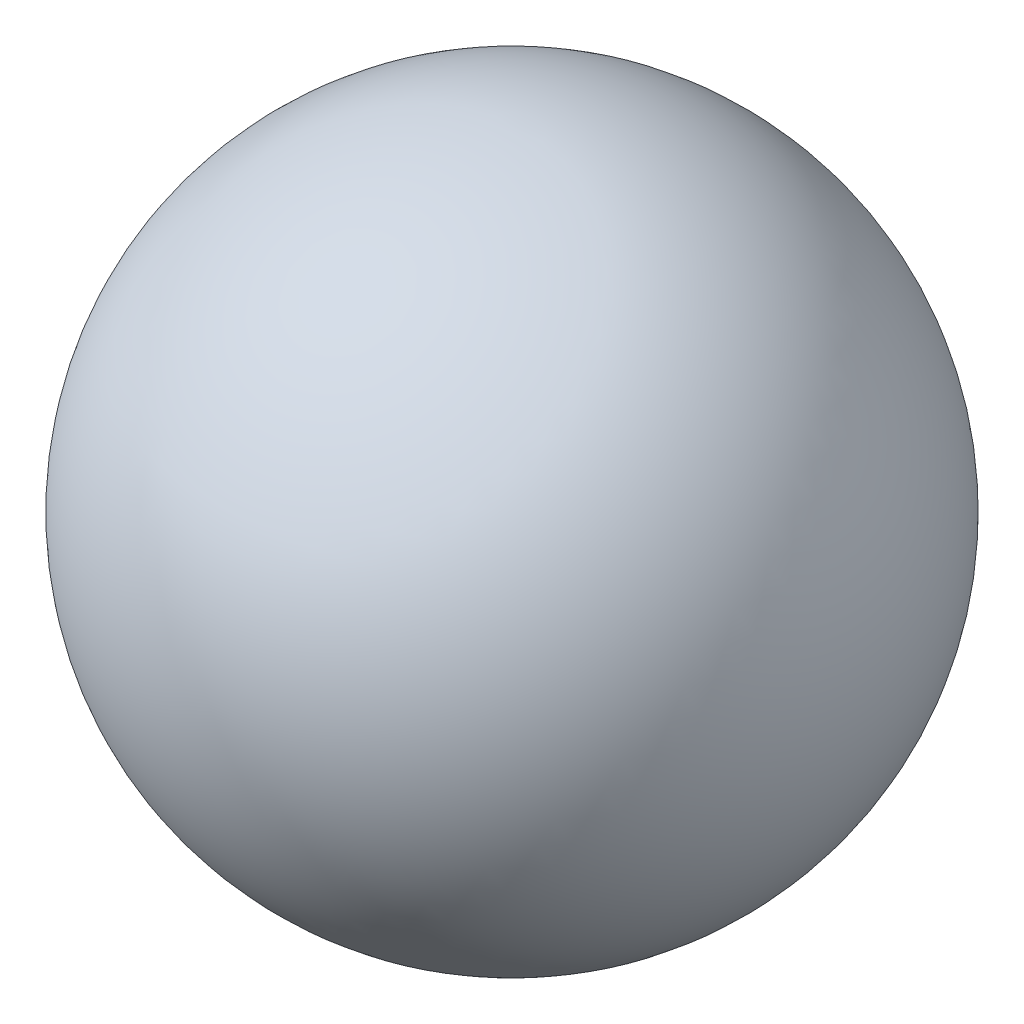
from build123d import *

# Parameters (mm, degrees)
SCALE_1_SCALE = 0.169230769


with BuildPart() as part:
    # 草图1 → 旋转1 (revolve)
    with BuildSketch(Plane.XY):
        with BuildLine():
            ThreePointArc((0, 12), (12, 0), (0, -12))
            Line((0, -12), (0, 0))
            Line((0, 0), (0, 12))
        make_face()
    revolve(axis=Axis((0, -12, 0), (0, 1, 0)))


with BuildPart() as part_1:
    # 缩放比例1: scaled about (0, 0, 0)
    add(part.part.scale(SCALE_1_SCALE))


solid = part_1.part
